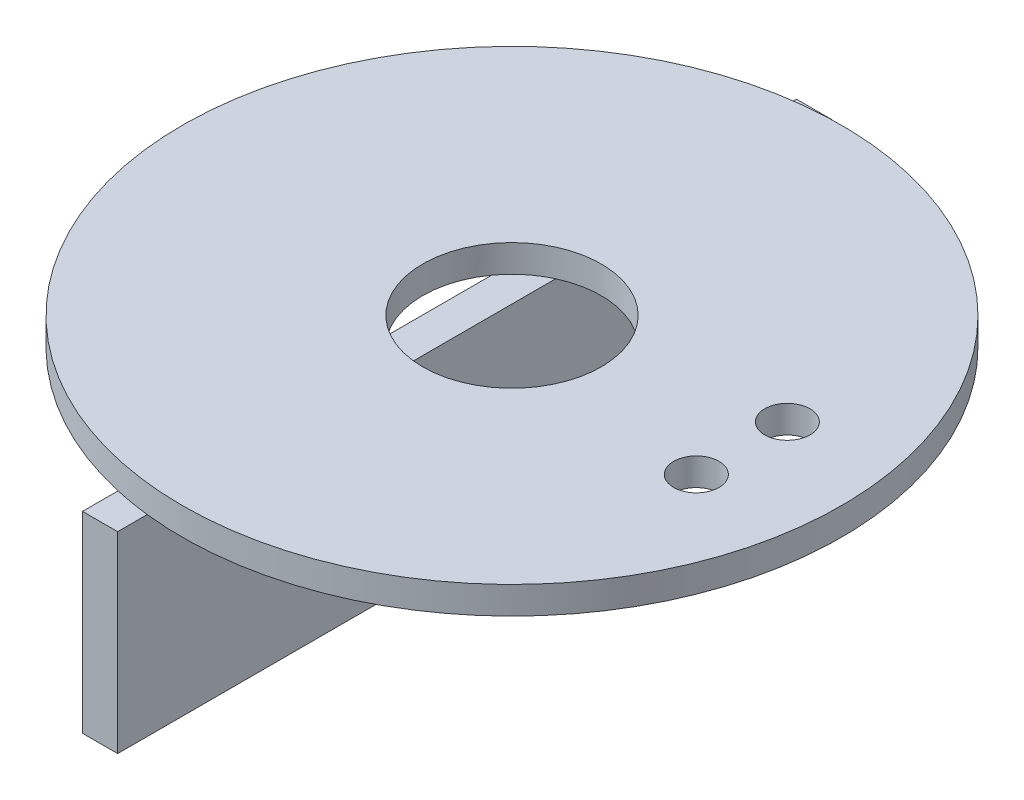
from build123d import *

# Parameters (mm, degrees)
SKETCH1_R           = 24
BOSS_EXTRUDE1_DEPTH = 2
SKETCH6_R           = 6.5
CUT_EXTRUDE4_DEPTH  = 2.4
SKETCH11_R          = 1.65
CUT_EXTRUDE8_DEPTH  = 35
SKETCH12_W          = 2.558537978
SKETCH12_H          = 52
BOSS_EXTRUDE2_DEPTH = 14


with BuildPart() as part:
    # Sketch1 → Boss-Extrude1 (new body)
    with BuildSketch(Plane(origin=(0, 0, 0), x_dir=(1, 0, 0), z_dir=(0, 1, 0))):
        with Locations(Location((0, 0, 0), (0, 0, 270))):
            Circle(SKETCH1_R)
    extrude(amount=BOSS_EXTRUDE1_DEPTH)

    # Sketch6 → Cut-Extrude4 (cut)
    with BuildSketch(Plane(origin=(0, 2, 0), x_dir=(1, 0, 0), z_dir=(0, 1, 0))):
        with Locations(Location((0, 0, 0), (0, 0, 270))):
            Circle(SKETCH6_R)
    extrude(amount=-CUT_EXTRUDE4_DEPTH, mode=Mode.SUBTRACT)

    # Sketch11 → Cut-Extrude8 (cut, through all)
    with BuildSketch(Plane.XZ.offset(-2)):
        with Locations(Location((16.74, 3.315, 0), (0, 0, 270))):
            Circle(SKETCH11_R)
        with Locations(Location((16.74, -3.315, 0), (0, 0, 270))):
            Circle(SKETCH11_R)
    extrude(amount=CUT_EXTRUDE8_DEPTH, mode=Mode.SUBTRACT)

    # Sketch12 → Boss-Extrude2 (add)
    with BuildSketch(Plane(origin=(0, 0, 0), x_dir=(1, 0, 0), z_dir=(0, 1, 0))):
        with Locations((-4, 0)):
            Rectangle(SKETCH12_W, SKETCH12_H)
    extrude(amount=-BOSS_EXTRUDE2_DEPTH)


solid = part.part
